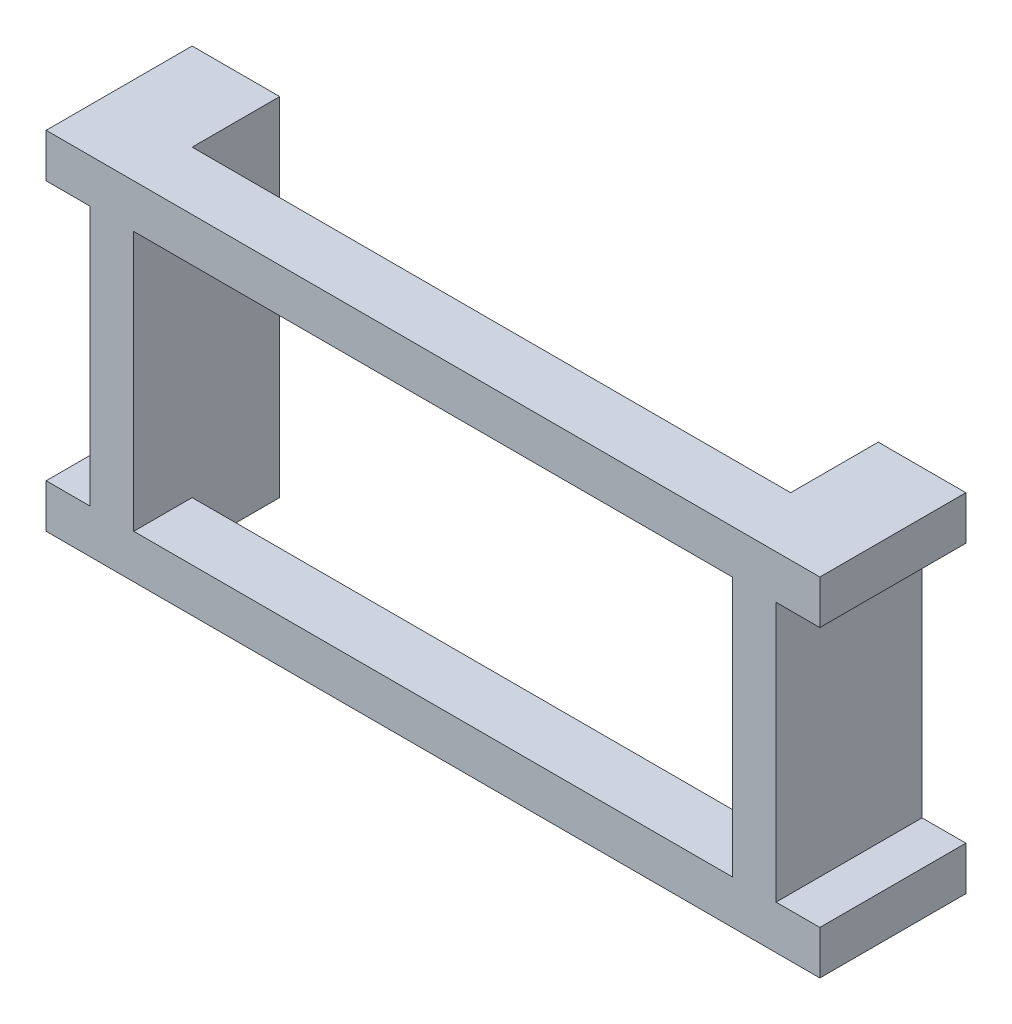
from build123d import *

# Parameters (mm, degrees)
SKETCH1_W           = 41
SKETCH1_H           = 17.79
BOSS_EXTRUDE1_DEPTH = 10
SKETCH10_W          = 41
SKETCH10_H          = 3
CUT_EXTRUDE1_DEPTH  = 6


with BuildPart() as part:
    # Sketch1 → Boss-Extrude1 (new body)
    with BuildSketch(Plane.XY):
        Polygon((12.281684518, 9.551958914), (15.281684518, 9.551958914), (15.281684518, 12.551958914), (-37.718315482, 12.551958914), (-37.718315482, 9.551958914), (-34.718315482, 9.551958914), (-34.718315482, -8.238041086), (-37.718315482, -8.238041086), (-37.718315482, -11.238041086), (15.281684518, -11.238041086), (15.281684518, -8.238041086), (12.281684518, -8.238041086), align=None)
        with Locations((-11.218315482, 0.656958914)):
            Rectangle(SKETCH1_W, SKETCH1_H, mode=Mode.SUBTRACT)
    extrude(amount=BOSS_EXTRUDE1_DEPTH)

    # Sketch10 → Cut-Extrude1 (cut)
    with BuildSketch(Plane(origin=(0, 0, 0), x_dir=(-1, 0, 0), z_dir=(0, 0, -1))):
        with Locations((11.218315482, -9.738041086)):
            Rectangle(SKETCH10_W, SKETCH10_H)
    cut_extrude1 = extrude(amount=-CUT_EXTRUDE1_DEPTH, mode=Mode.SUBTRACT)

    # Mirror3: Cut-Extrude1 across plane
    add(cut_extrude1.mirror(Plane.ZX.offset(0.656958914)), mode=Mode.SUBTRACT)


solid = part.part
